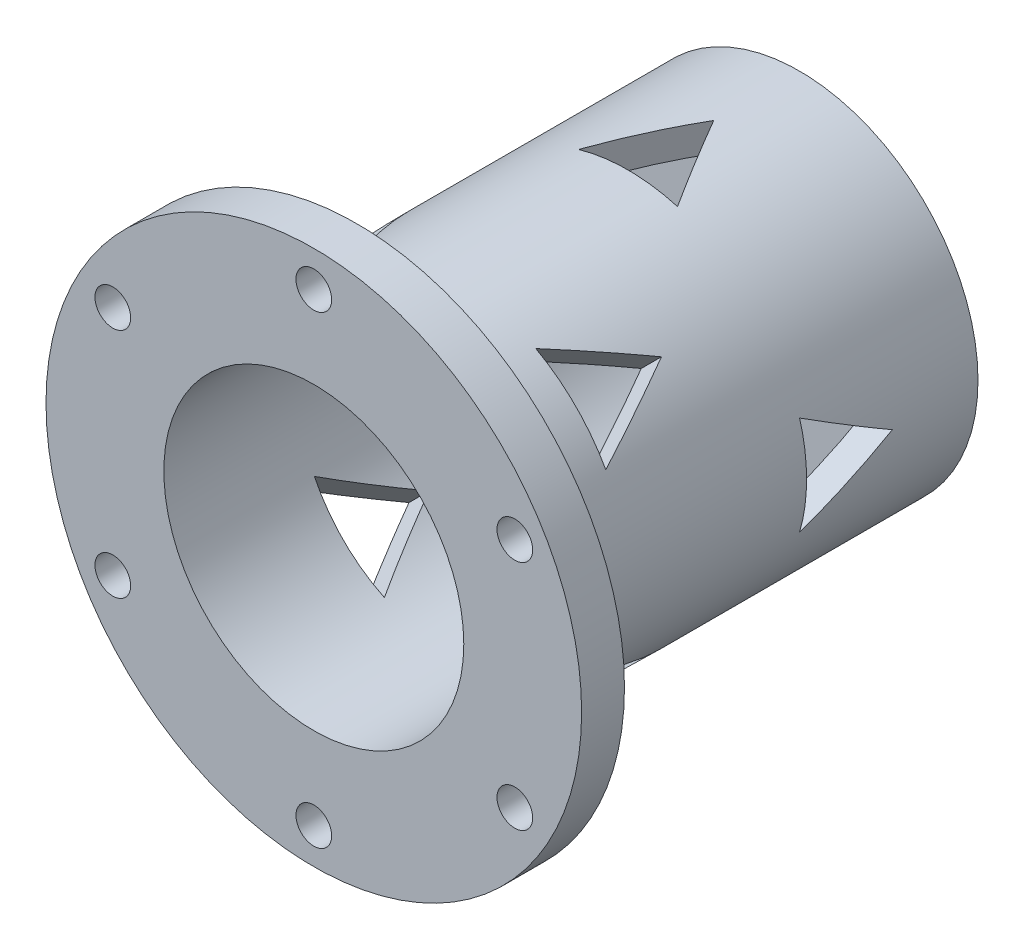
from build123d import *

# Parameters (mm, degrees)
SKETCH_1_R               = 25
EXTRUDE_1_DEPTH          = 4
SKETCH_2_R               = 25
SKETCH_2_R_2             = 21
EXTRUDE_2_DEPTH          = 64
EXTRUDE_START            = -6
SKETCH_3_R               = 37.5
SKETCH_3_R_2             = 21
SKETCH_3_R_3             = 2.5
EXTRUDE_3_DEPTH          = 6
FILLET_1_R               = 3
SKETCH_4_R               = 4.25
SKETCH_4_R_2             = 1.5
CUT_EXTRUDE_1_DEPTH      = 5
CUT_EXTRUDE_2_DEPTH      = 50
PATTERN_CIRCULAR_2_COUNT = 4
CUT_EXTRUDE_3_DEPTH      = 100
PATTERN_CIRCULAR_3_COUNT = 4
CUT_EXTRUDE_4_DEPTH      = 2


with BuildPart() as part:
    # 草图1 → 凸台-拉伸1 (new body)
    with BuildSketch(Plane.XY):
        Circle(SKETCH_1_R)
    extrude(amount=EXTRUDE_1_DEPTH)

    # 草图2 → 凸台-拉伸2 (add)
    with BuildSketch(Plane.XY.offset(4)):
        Circle(SKETCH_2_R)
        Circle(SKETCH_2_R_2, mode=Mode.SUBTRACT)
    extrude(amount=EXTRUDE_2_DEPTH)

    # 草图3 → 凸台-拉伸3 (add)
    with BuildSketch(Plane.XY.offset(68).offset(EXTRUDE_START)):
        Circle(SKETCH_3_R)
        Circle(SKETCH_3_R_2, mode=Mode.SUBTRACT)
        with Locations((0, 32.5)):
            Circle(SKETCH_3_R_3, mode=Mode.SUBTRACT)
        with Locations((28.145825623, 16.25)):
            Circle(SKETCH_3_R_3, mode=Mode.SUBTRACT)
        with Locations((28.145825623, -16.25)):
            Circle(SKETCH_3_R_3, mode=Mode.SUBTRACT)
        with Locations((0, -32.5)):
            Circle(SKETCH_3_R_3, mode=Mode.SUBTRACT)
        with Locations((-28.145825623, -16.25)):
            Circle(SKETCH_3_R_3, mode=Mode.SUBTRACT)
        with Locations((-28.145825623, 16.25)):
            Circle(SKETCH_3_R_3, mode=Mode.SUBTRACT)
    extrude(amount=EXTRUDE_3_DEPTH)

    # 圆角1
    fillet_1_edges = [part.edges().sort_by_distance(p)[0] for p in [
        (-25, 0, 62),
    ]]
    fillet(fillet_1_edges, radius=FILLET_1_R)

    # 草图4 → 切除-拉伸1 (cut)
    with BuildSketch(Plane(origin=(0, 0, 0), x_dir=(-1, 0, 0), z_dir=(0, 0, -1))):
        Circle(SKETCH_4_R)
        with Locations((0, 9.25)):
            Circle(SKETCH_4_R_2)
        with Locations((7.75, 0)):
            Circle(SKETCH_4_R_2)
        with Locations(Location((0, -9.25, 0), (0, 0, 180))):
            Circle(SKETCH_4_R_2)
        with Locations(Location((-7.75, 0, 0), (0, 0, 180))):
            Circle(SKETCH_4_R_2)
    extrude(amount=-CUT_EXTRUDE_1_DEPTH, mode=Mode.SUBTRACT)

    # 草图5 → 切除-拉伸2 (cut, symmetric)
    with BuildSketch(Plane(origin=(0, 0, 0), x_dir=(0, 0, -1), z_dir=(1, 0, 0))):
        Polygon((-12, 0), (-24, 6.92820323), (-24, -6.92820323), align=None)
    cut_extrude_2 = extrude(amount=CUT_EXTRUDE_2_DEPTH, both=True, mode=Mode.SUBTRACT)

    # 阵列(圆周)2: 切除-拉伸2 ×4 about axis
    pattern_circular_2_axis = Axis((0, 0, 0), (0, 0, 1))
    for i in range(1, PATTERN_CIRCULAR_2_COUNT):
        add(cut_extrude_2.rotate(pattern_circular_2_axis, i * 360 / PATTERN_CIRCULAR_2_COUNT), mode=Mode.SUBTRACT)

    # 草图7 → 切除-拉伸3 (cut)
    with BuildSketch(Plane(origin=(17.67766953, 17.67766953, 0), x_dir=(0.7071067811865487, -0.7071067811865465, 0), z_dir=(0.7071067811865465, 0.7071067811865487, 0))):
        Polygon((0, -37), (-6.92820323, -49), (6.92820323, -49), align=None)
    cut_extrude_3 = extrude(amount=-CUT_EXTRUDE_3_DEPTH, mode=Mode.SUBTRACT)

    # 阵列(圆周)3: 切除-拉伸3 ×4 about axis
    pattern_circular_3_axis = Axis((0, 0, 0), (0, 0, 1))
    for i in range(1, PATTERN_CIRCULAR_3_COUNT):
        add(cut_extrude_3.rotate(pattern_circular_3_axis, i * 360 / PATTERN_CIRCULAR_3_COUNT), mode=Mode.SUBTRACT)

    # 草图8 → 切除-拉伸4 (cut)
    with BuildSketch(Plane(origin=(0, 0, 0), x_dir=(-1, 0, 0), z_dir=(0, 0, -1))):
        with BuildLine():
            ThreePointArc((-12.374368671, -12.374368671), (-17.5, 0), (-12.374368671, 12.374368671))
            Line((-12.374368671, 12.374368671), (-14.849242405, 14.849242405))
            ThreePointArc((-14.849242405, 14.849242405), (-21, 0), (-14.849242405, -14.849242405))
            Line((-14.849242405, -14.849242405), (-12.374368671, -12.374368671))
        make_face()
        with BuildLine():
            Line((14.849242405, 14.849242405), (12.374368671, 12.374368671))
            ThreePointArc((12.374368671, 12.374368671), (16.167891819, 6.696960066), (17.5, 0))
            ThreePointArc((17.5, 0), (16.167891819, -6.696960066), (12.374368671, -12.374368671))
            Line((12.374368671, -12.374368671), (14.849242405, -14.849242405))
            ThreePointArc((14.849242405, -14.849242405), (19.401470183, -8.03635208), (21, 0))
            ThreePointArc((21, 0), (19.401470183, 8.03635208), (14.849242405, 14.849242405))
        make_face()
    extrude(amount=-CUT_EXTRUDE_4_DEPTH, mode=Mode.SUBTRACT)


solid = part.part
